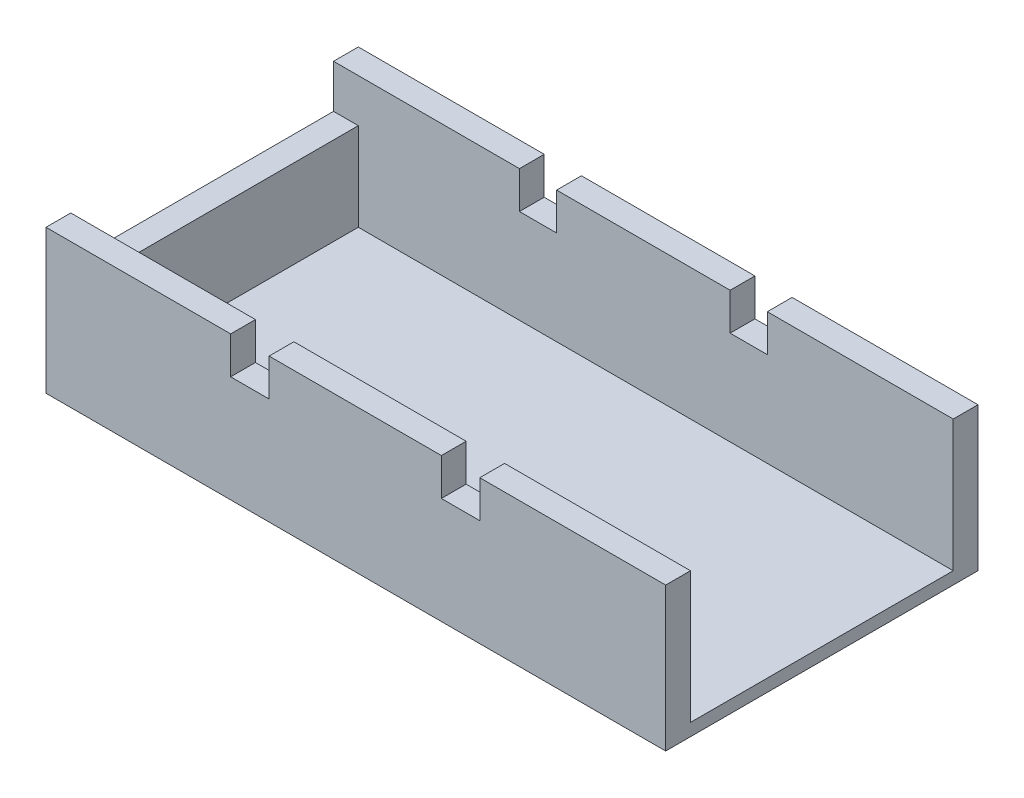
from build123d import *

# Parameters (mm, degrees)
SKETCH_1_W      = 50
SKETCH_1_H      = 25.2
EXTRUDE_1_DEPTH = 1
SKETCH_2_W      = 50
SKETCH_2_H      = 2
EXTRUDE_2_DEPTH = 7.6
SKETCH_4_W      = 15
SKETCH_4_H      = 2
SKETCH_4_W_2    = 14
EXTRUDE_3_DEPTH = 3
SKETCH_5_W      = 14.9
SKETCH_5_H      = 2
SKETCH_5_W_2    = 13.9
SKETCH_5_W_3    = 15
EXTRUDE_4_DEPTH = 3
SKETCH_6_W      = 2
SKETCH_6_H      = 25.2
EXTRUDE_5_DEPTH = 3.6
SKETCH_7_W      = 2
SKETCH_7_H      = 21.2
EXTRUDE_6_DEPTH = 3.5


with BuildPart() as part:
    # 草图1 → 凸台-拉伸1 (new body)
    with BuildSketch(Plane(origin=(0, 0, 0), x_dir=(1, 0, 0), z_dir=(0, 1, 0))):
        Rectangle(SKETCH_1_W, SKETCH_1_H)
    extrude(amount=EXTRUDE_1_DEPTH)

    # 草图2 → 凸台-拉伸2 (add)
    with BuildSketch(Plane(origin=(0, 1, 0), x_dir=(1, 0, 0), z_dir=(0, 1, 0))):
        with Locations((0, 11.6)):
            Rectangle(SKETCH_2_W, SKETCH_2_H)
        with Locations((0, -11.6)):
            Rectangle(SKETCH_2_W, SKETCH_2_H)
    extrude(amount=EXTRUDE_2_DEPTH)

    # 草图4 → 凸台-拉伸3 (add)
    with BuildSketch(Plane(origin=(0, 8.6, 0), x_dir=(1, 0, 0), z_dir=(0, 1, 0))):
        with Locations((-17.5, 11.6)):
            Rectangle(SKETCH_4_W, SKETCH_4_H)
        with Locations((0, 11.6)):
            Rectangle(SKETCH_4_W_2, SKETCH_4_H)
        with Locations((17.5, 11.6)):
            Rectangle(SKETCH_4_W, SKETCH_4_H)
    extrude(amount=EXTRUDE_3_DEPTH)

    # 草图5 → 凸台-拉伸4 (add)
    with BuildSketch(Plane(origin=(0, 8.6, 0), x_dir=(1, 0, 0), z_dir=(0, 1, 0))):
        with Locations((-17.55, -11.6)):
            Rectangle(SKETCH_5_W, SKETCH_5_H)
        with Locations((-0.05, -11.6)):
            Rectangle(SKETCH_5_W_2, SKETCH_5_H)
        with Locations((17.5, -11.6)):
            Rectangle(SKETCH_5_W_3, SKETCH_5_H)
    extrude(amount=EXTRUDE_4_DEPTH)

    # 草图6 → 凸台-拉伸5 (add)
    with BuildSketch(Plane(origin=(0, 1, 0), x_dir=(1, 0, 0), z_dir=(0, 1, 0))):
        with Locations((-24, 0)):
            Rectangle(SKETCH_6_W, SKETCH_6_H)
    extrude(amount=EXTRUDE_5_DEPTH)

    # 草图7 → 凸台-拉伸6 (add)
    with BuildSketch(Plane(origin=(0, 4.6, 0), x_dir=(1, 0, 0), z_dir=(0, 1, 0))):
        with Locations((-24, 0)):
            Rectangle(SKETCH_7_W, SKETCH_7_H)
    extrude(amount=EXTRUDE_6_DEPTH)


solid = part.part
